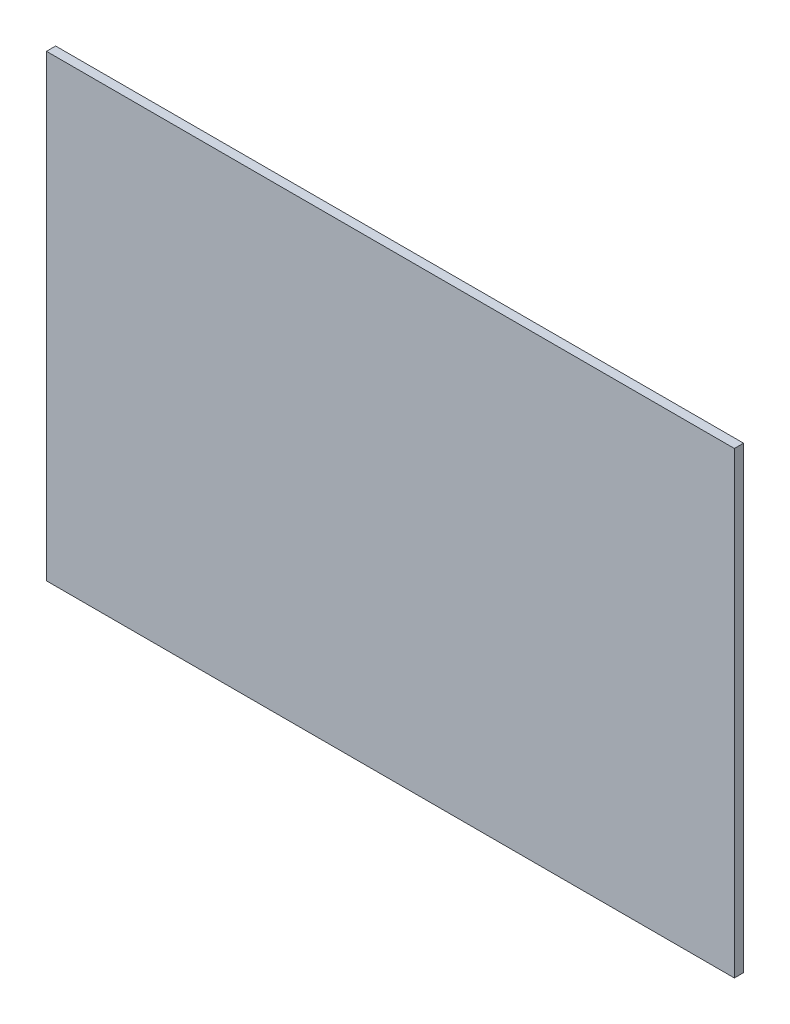
from build123d import *

# Parameters (mm, degrees)
SKETCH1_W           = 900
SKETCH1_H           = 600
BOSS_EXTRUDE1_DEPTH = 12


with BuildPart() as part:
    # Sketch1 → Boss-Extrude1 (new body)
    with BuildSketch(Plane.XY):
        with Locations((97.346938776, 300)):
            Rectangle(SKETCH1_W, SKETCH1_H)
    extrude(amount=-BOSS_EXTRUDE1_DEPTH)


solid = part.part
